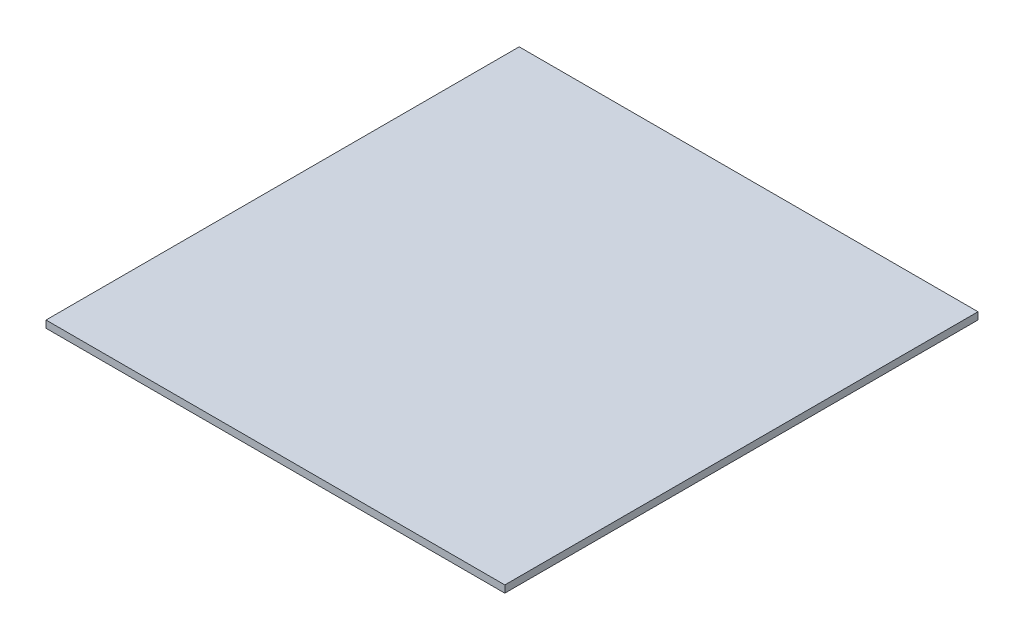
from build123d import *

# Parameters (mm, degrees)
SKETCH1_W           = 320
SKETCH1_H           = 330
BOSS_EXTRUDE1_DEPTH = 5


with BuildPart() as part:
    # Sketch1 → Boss-Extrude1 (new body)
    with BuildSketch(Plane(origin=(0, 0, 0), x_dir=(1, 0, 0), z_dir=(0, 1, 0))):
        with Locations((-13, -30)):
            Rectangle(SKETCH1_W, SKETCH1_H)
    extrude(amount=BOSS_EXTRUDE1_DEPTH)


solid = part.part
